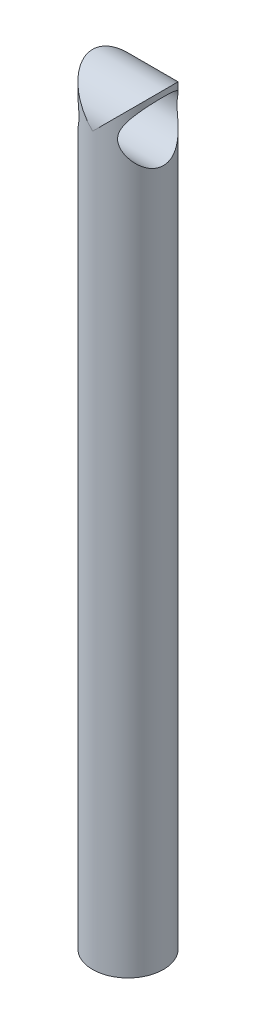
from build123d import *

# Parameters (mm, degrees)
SKETCH2_R               = 4.73075
BOSS_EXTRUDE2_DEPTH     = 101.6
CUT_EXTRUDE1_DEPTH      = 102.820037277
CUT_EXTRUDE1_DEPTH_BACK = 102.820037277
SKETCH3_R               = 3.96875


with BuildPart() as part:
    # Sketch2 → Boss-Extrude2 (new body)
    with BuildSketch(Plane(origin=(0, 0, 0), x_dir=(1, 0, 0), z_dir=(0, 1, 0))):
        with Locations(Location((0, 0, 0), (0, 0, 270))):
            Circle(SKETCH2_R)
    extrude(amount=BOSS_EXTRUDE2_DEPTH)

    # Sketch3 → Cut-Extrude1 (cut, two sides: drawn at the far end of the back side and taken through both)
    with BuildSketch(Plane(origin=(0, 0, 0), x_dir=(0, 0, -1), z_dir=(1, 0, 0)).offset(-CUT_EXTRUDE1_DEPTH_BACK)):
        with Locations((0, 96.86925)):
            Circle(SKETCH3_R)
        with BuildLine():
            Line((-4.73075, 101.6), (-4.73075, 96.86925))
            ThreePointArc((-4.73075, 96.86925), (-3.345145405, 100.214395405), (0, 101.6))
            Line((0, 101.6), (-4.73075, 101.6))
        make_face()
        with BuildLine():
            ThreePointArc((0, 101.6), (3.345145405, 100.214395405), (4.73075, 96.86925))
            Line((4.73075, 96.86925), (4.73075, 101.6))
            Line((4.73075, 101.6), (0, 101.6))
        make_face()
    extrude(amount=CUT_EXTRUDE1_DEPTH + CUT_EXTRUDE1_DEPTH_BACK, mode=Mode.SUBTRACT)


solid = part.part
